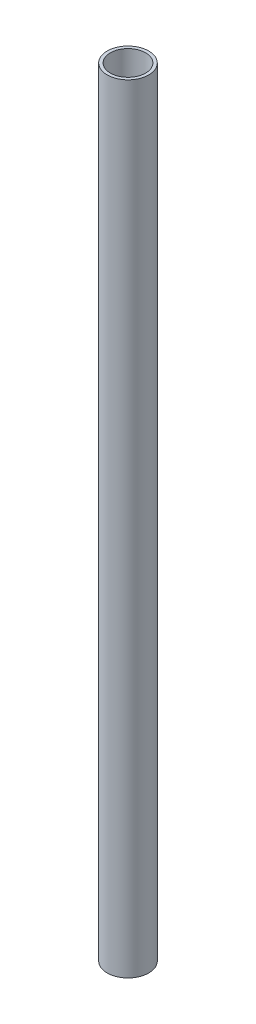
from build123d import *

# Parameters (mm, degrees)
SKETCH_1_R      = 16
SKETCH_1_R_2    = 13.6
EXTRUDE_1_DEPTH = 600


with BuildPart() as part:
    # 草图1 → 凸台-拉伸1 (new body)
    with BuildSketch(Plane(origin=(0, 0, 0), x_dir=(1, 0, 0), z_dir=(0, 1, 0))):
        with Locations(Location((0, 0, 0), (0, 0, 270))):
            Circle(SKETCH_1_R)
        with Locations(Location((0, 0, 0), (0, 0, 270))):
            Circle(SKETCH_1_R_2, mode=Mode.SUBTRACT)
    extrude(amount=EXTRUDE_1_DEPTH)


solid = part.part
